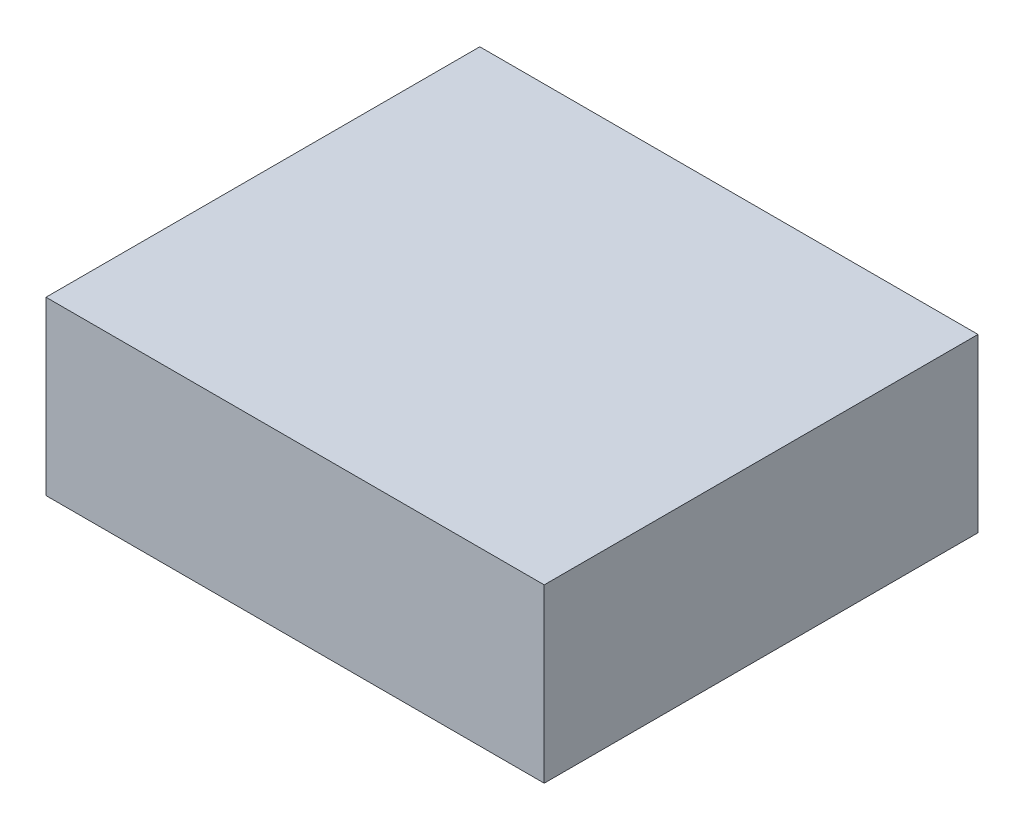
from build123d import *

# Parameters (mm, degrees)
SKETCH1_W           = 11.6
SKETCH1_H           = 10.1
BOSS_EXTRUDE1_DEPTH = 4
SKETCH2_W           = 3
SKETCH2_H           = 2.5
BOSS_EXTRUDE2_DEPTH = 0.0001


with BuildPart() as part:
    # Sketch1 → Boss-Extrude1 (new body)
    with BuildSketch(Plane(origin=(0, 0, 0), x_dir=(1, 0, 0), z_dir=(0, 1, 0))):
        Rectangle(SKETCH1_W, SKETCH1_H)
    extrude(amount=BOSS_EXTRUDE1_DEPTH)

    # Sketch2 → Boss-Extrude2 (add)
    with BuildSketch(Plane.XZ):
        with Locations((-4.3, 0)):
            Rectangle(SKETCH2_W, SKETCH2_H)
        with Locations((4.3, 0)):
            Rectangle(SKETCH2_W, SKETCH2_H)
    extrude(amount=BOSS_EXTRUDE2_DEPTH)


solid = part.part
